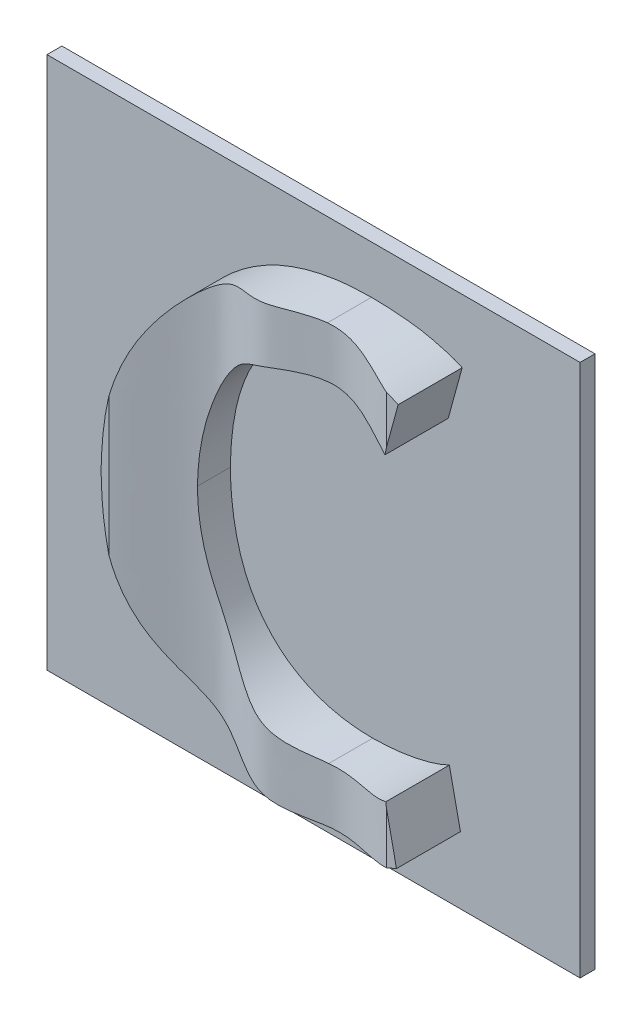
from build123d import *

# Parameters (mm, degrees)
SKETCH1_W           = 50
SKETCH1_H           = 50
BOSS_EXTRUDE1_DEPTH = 1.4
BOSS_EXTRUDE4_DEPTH = 6
CUT_EXTRUDE3_DEPTH  = 57.389360845


with BuildPart() as part:
    # Sketch1 → Boss-Extrude1 (new body)
    with BuildSketch(Plane.XY):
        Rectangle(SKETCH1_W, SKETCH1_H)
    extrude(amount=BOSS_EXTRUDE1_DEPTH)

    # Sketch6 → Boss-Extrude4 (add)
    with BuildSketch(Plane.XY.offset(1.4)):
        with BuildLine():
            add(Edge.make_bspline(
                [(12.740355156, -13.835261418), (12.507058823, -13.940440513), (12.025764164, -14.157426934), (11.249168548, -14.425150295), (10.40641946, -14.667153812), (9.177517193, -14.93586533), (7.550866272, -15.185617479), (6.220300875, -15.227532333), (5.542986425, -15.248868778)],
                knots=[0, 0, 0, 0, 0.623279357, 1.285836859, 1.999327964, 2.758722695, 4.350051821, 6, 6, 6, 6], degree=3))
            add(Edge.make_bspline(
                [(5.542986425, -15.248868778), (5.037124458, -15.235233018), (4.049445679, -15.208609647), (2.609288197, -15.01861503), (1.254947776, -14.703428199), (-0.014461162, -14.26437965), (-1.198984051, -13.704338981), (-2.299020481, -13.020748809), (-3.31861519, -12.218675513), (-4.237661209, -11.283086847), (-5.071263117, -10.243731023), (-5.790485494, -9.08494893), (-6.402406911, -7.821348027), (-6.899041262, -6.445237289), (-7.289044395, -4.963288937), (-7.57144397, -3.374372394), (-7.757571108, -1.678530872), (-7.784184046, -0.510816893), (-7.797888386, 0.090497738)],
                knots=[0, 0, 0, 0, 1.05357022, 2.05706105, 3.019831997, 3.945549259, 4.849673394, 5.743319306, 6.637992512, 7.545159443, 8.469260999, 9.40786221, 10.379774602, 11.388606811, 12.450446757, 13.567948197, 14.747614263, 16, 16, 16, 16], degree=3))
            add(Edge.make_bspline(
                [(-7.797888386, 0.090497738), (-7.779078005, 0.722018082), (-7.742565842, 1.947839835), (-7.544048241, 3.722189783), (-7.241062865, 5.378657343), (-6.808339636, 6.907818691), (-6.284347512, 8.327111984), (-5.635707562, 9.620504103), (-4.869964458, 10.793189526), (-3.990659412, 11.83578479), (-3.02542496, 12.753513898), (-1.991551512, 13.555989061), (-0.884817901, 14.228687157), (0.290696011, 14.78235691), (1.534824832, 15.212951383), (2.845624226, 15.522784821), (4.225573673, 15.705722308), (5.167872668, 15.727801574), (5.648567119, 15.739064857)],
                knots=[0, 0, 0, 0, 1.300058967, 2.523498372, 3.671327638, 4.762385131, 5.790754738, 6.781204902, 7.734179646, 8.667035103, 9.582038544, 10.471113154, 11.35590086, 12.242457161, 13.14087904, 14.060872889, 15.010794189, 16, 16, 16, 16], degree=3))
            add(Edge.make_bspline(
                [(5.648567119, 15.739064857), (6.010735742, 15.733085122), (6.715937199, 15.721441602), (7.743156331, 15.63671353), (8.711062927, 15.504972067), (9.614878063, 15.310977922), (10.461778439, 15.096297406), (11.241795468, 14.844024991), (11.966689753, 14.586704494), (12.414696386, 14.377486892), (12.631975867, 14.2760181)],
                knots=[0, 0, 0, 0, 1.208363836, 2.352881735, 3.437133088, 4.465326887, 5.435785295, 6.351019915, 7.200258411, 8, 8, 8, 8], degree=3))
            Line((12.631975867, 14.2760181), (13.939288155, 19.038800316))
            add(Edge.make_bspline(
                [(13.939288155, 19.038800316), (13.776108833, 19.115462646), (13.402679863, 19.290901142), (12.74439205, 19.517219623), (11.923683981, 19.744896994), (10.950141389, 20.000018824), (9.805591077, 20.220178136), (8.494621051, 20.368208332), (7.020336297, 20.477012073), (5.983133525, 20.495533777), (5.437405732, 20.505279035)],
                knots=[0, 0, 0, 0, 0.497728815, 1.139031319, 1.919228026, 2.850533018, 3.918187005, 5.13515125, 6.492650013, 8, 8, 8, 8], degree=3))
            add(Edge.make_bspline(
                [(5.437405732, 20.505279035), (4.747832892, 20.490083592), (3.396707551, 20.460310163), (1.417661675, 20.204849204), (-0.46342248, 19.793283231), (-2.25039336, 19.217825099), (-3.940018186, 18.477680694), (-5.530231259, 17.566719062), (-7.025326357, 16.497521523), (-8.414203186, 15.267954664), (-9.680211715, 13.878996016), (-10.786971395, 12.322239834), (-11.7235314, 10.606904294), (-12.49364598, 8.736772171), (-13.101204176, 6.715112407), (-13.551995005, 4.540344672), (-13.839141555, 2.209362149), (-13.898529482, 0.601626777), (-13.929110106, -0.226244344)],
                knots=[0, 0, 0, 0, 1.03258902, 2.023219463, 2.983439502, 3.913466857, 4.830690834, 5.741453413, 6.65369381, 7.579319873, 8.515001589, 9.462699019, 10.433390624, 11.436184352, 12.486830696, 13.590904696, 14.759484638, 16, 16, 16, 16], degree=3))
            add(Edge.make_bspline(
                [(-13.929110106, -0.226244344), (-13.909010256, -1.008847512), (-13.869927599, -2.53056098), (-13.604345563, -4.740626143), (-13.211990709, -6.815285092), (-12.664389322, -8.753457918), (-11.959090382, -10.550263204), (-11.116094938, -12.21712337), (-10.105224498, -13.737826644), (-8.95903547, -15.125303424), (-7.672436725, -16.352408088), (-6.279299909, -17.43434357), (-4.769181835, -18.342119017), (-3.149512946, -19.084993339), (-1.419940378, -19.6658618), (0.421120772, -20.08707541), (2.373388779, -20.345449592), (3.712128393, -20.386333945), (4.39668175, -20.407239819)],
                knots=[0, 0, 0, 0, 1.218475598, 2.369234888, 3.461691683, 4.503752951, 5.500362793, 6.463244622, 7.406714516, 8.337948286, 9.259888006, 10.169706265, 11.079364509, 11.997173012, 12.939204436, 13.91536257, 14.934038004, 16, 16, 16, 16], degree=3))
            add(Edge.make_bspline(
                [(4.39668175, -20.407239819), (4.924820749, -20.400424483), (5.944497528, -20.38726613), (7.420977392, -20.274753847), (8.791244358, -20.124078567), (10.049723914, -19.905947465), (11.179809969, -19.640680074), (12.17861466, -19.36658026), (13.035668545, -19.071827804), (13.543595189, -18.83494219), (13.778280543, -18.725490196)],
                knots=[0, 0, 0, 0, 1.319898282, 2.548324642, 3.699499855, 4.764539851, 5.738494737, 6.599877469, 7.353079316, 8, 8, 8, 8], degree=3))
            Line((13.778280543, -18.725490196), (12.740355156, -13.835261418))
        make_face()
    extrude(amount=BOSS_EXTRUDE4_DEPTH)

    # Sketch8 → Cut-Extrude3 (cut, through all)
    with BuildSketch(Plane.XZ.offset(25)):
        with BuildLine():
            Line((-17.5, 1.4), (-17.5, 8.4))
            Line((-17.5, 8.4), (-11.666666667, 8.4))
            Line((-11.666666667, 8.4), (-5.833333333, 8.4))
            Line((-5.833333333, 8.4), (0, 8.4))
            Line((0, 8.4), (5.833333333, 8.4))
            Line((5.833333333, 8.4), (11.666666667, 8.4))
            Line((11.666666667, 8.4), (17.5, 8.4))
            Line((17.5, 8.4), (17.5, 1.4))
            add(Edge.make_bspline(
                [(-17.5, 1.4), (-17.5, 9.571949147), (-11.754616831, 7.00066411), (-5.954620329, 2.706943707), (-0.18125829, 7.586155158), (5.977618097, 4.593509306), (12.102502588, 7.363830895), (17.5, 8.890385595), (17.5, 1.4)],
                knots=[0, 0, 0, 0, 0.193816706, 0.350261096, 0.504028501, 0.650060542, 0.799445025, 1, 1, 1, 1], degree=3))
        make_face()
    extrude(amount=-CUT_EXTRUDE3_DEPTH, mode=Mode.SUBTRACT)


solid = part.part
